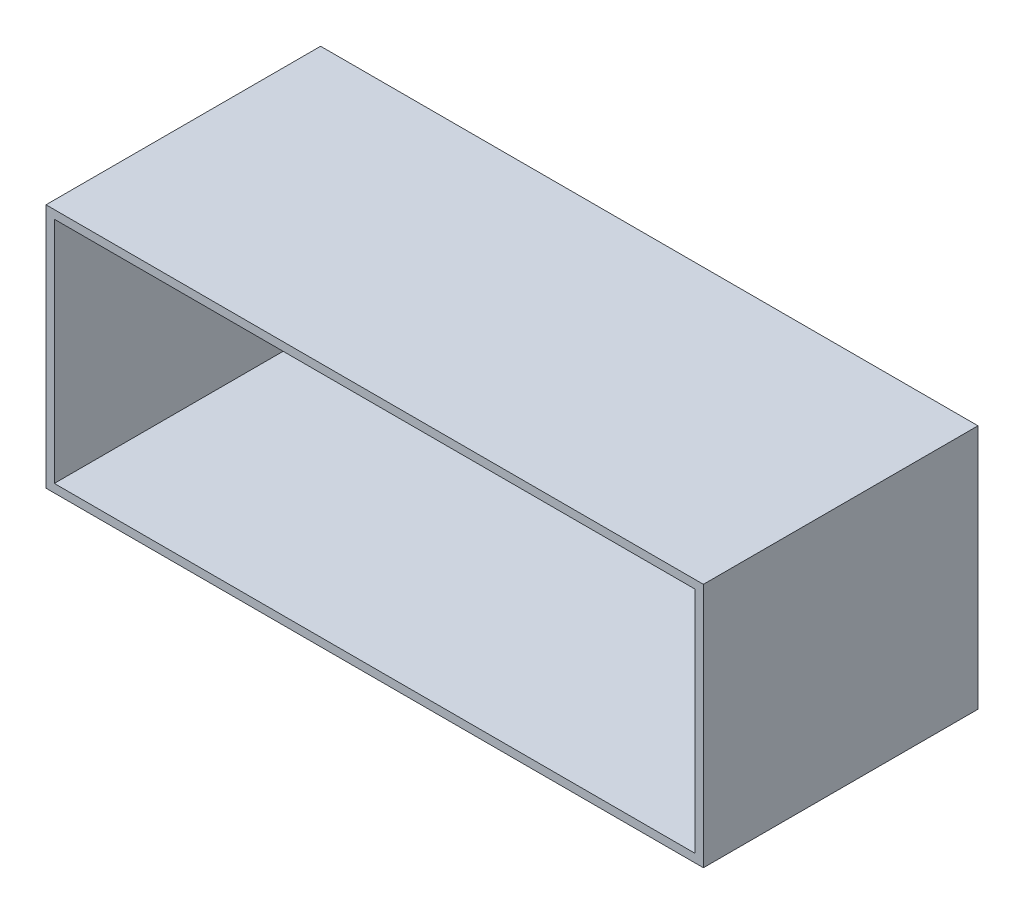
from build123d import *

# Parameters (mm, degrees)
SKETCH1_W     = 158
SKETCH1_H     = 59
SKETCH1_W_2   = 154
SKETCH1_H_2   = 55
PROFILE_DEPTH = 66
SKETCH2_W     = 154
SKETCH2_H     = 55
BACK_DEPTH    = 2


with BuildPart() as part:
    # Sketch1 → Profile (new body)
    with BuildSketch(Plane.XY):
        with Locations((79, 29.5)):
            Rectangle(SKETCH1_W, SKETCH1_H)
        with Locations((79, 29.5)):
            Rectangle(SKETCH1_W_2, SKETCH1_H_2, mode=Mode.SUBTRACT)
    extrude(amount=PROFILE_DEPTH)

    # Sketch2 → Back (add)
    with BuildSketch(Plane.XY):
        with Locations((79, 29.5)):
            Rectangle(SKETCH2_W, SKETCH2_H)
    extrude(amount=BACK_DEPTH)


solid = part.part
